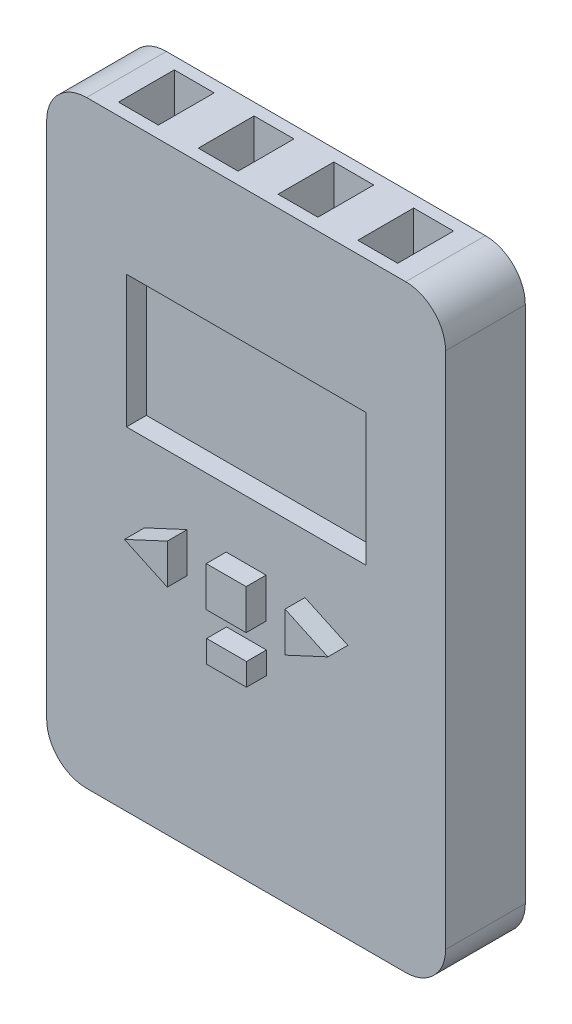
from build123d import *

# Parameters (mm, degrees)
BOSS_EXTRUDE1_DEPTH   = 2
SKETCH3_W             = 1
SKETCH3_H             = 1.4
CUT_EXTRUDE2_DEPTH    = 1
SKETCH2_W             = 1
SKETCH2_H             = 1.4
CUT_EXTRUDE3_DEPTH    = 1
SKETCH4_W             = 6
SKETCH4_H             = 3.316332314
SKETCH4_W_2           = 1
SKETCH4_H_2           = 1
SKETCH4_H_3           = 0.559018778
CUT_EXTRUDE4_DEPTH    = 0.5
BOSS_EXTRUDE2_DEPTH   = 0.5
SKETCH5_W             = 1
SKETCH5_H             = 1
BOSS_EXTRUDE2_2_DEPTH = 0.5
SKETCH5_H_2           = 0.559018778
BOSS_EXTRUDE2_3_DEPTH = 0.5
BOSS_EXTRUDE2_4_DEPTH = 0.5


with BuildPart() as part:
    # Sketch1 → Boss-Extrude1 (new body)
    with BuildSketch(Plane.XY):
        with BuildLine():
            Line((-4, 7.5), (4, 7.5))
            ThreePointArc((4, 7.5), (4.707106781, 7.207106781), (5, 6.5))
            Line((5, 6.5), (5, -6.5))
            ThreePointArc((5, -6.5), (4.707106781, -7.207106781), (4, -7.5))
            Line((4, -7.5), (-4, -7.5))
            ThreePointArc((-4, -7.5), (-4.707106781, -7.207106781), (-5, -6.5))
            Line((-5, -6.5), (-5, 6.5))
            ThreePointArc((-5, 6.5), (-4.707106781, 7.207106781), (-4, 7.5))
        make_face()
    extrude(amount=BOSS_EXTRUDE1_DEPTH)

    # Sketch3 → Cut-Extrude2 (cut)
    with BuildSketch(Plane(origin=(0, -7.5, 0), x_dir=(-1, 0, 0), z_dir=(0, -1, 0))):
        with Locations((-3, -1)):
            Rectangle(SKETCH3_W, SKETCH3_H)
        with Locations((-1, -1)):
            Rectangle(SKETCH3_W, SKETCH3_H)
        with Locations((1, -1)):
            Rectangle(SKETCH3_W, SKETCH3_H)
        with Locations((3, -1)):
            Rectangle(SKETCH3_W, SKETCH3_H)
    extrude(amount=-CUT_EXTRUDE2_DEPTH, mode=Mode.SUBTRACT)

    # Sketch2 → Cut-Extrude3 (cut)
    with BuildSketch(Plane(origin=(0, 7.5, 0), x_dir=(1, 0, 0), z_dir=(0, 1, 0))):
        with Locations((-1, -1)):
            Rectangle(SKETCH2_W, SKETCH2_H)
        with Locations((1, -1)):
            Rectangle(SKETCH2_W, SKETCH2_H)
        with Locations((3, -1)):
            Rectangle(SKETCH2_W, SKETCH2_H)
        with Locations((-3, -1)):
            Rectangle(SKETCH2_W, SKETCH2_H)
    extrude(amount=-CUT_EXTRUDE3_DEPTH, mode=Mode.SUBTRACT)

    # Sketch4 → Cut-Extrude4 (cut)
    with BuildSketch(Plane.XY.offset(2)):
        with Locations((0, 2.505950357)):
            Rectangle(SKETCH4_W, SKETCH4_H)
        Polygon((1.475933968, -0.619829312), (1.475933968, -1.619829312), (2.550668767, -1.119829312), align=None)
        with Locations((0, -1.119829312)):
            Rectangle(SKETCH4_W_2, SKETCH4_H_2)
        with Locations((0.009064429, -2.520688379)):
            Rectangle(SKETCH4_W_2, SKETCH4_H_3)
        Polygon((-1.475933968, -0.619829312), (-1.475933968, -1.619829312), (-2.550668767, -1.119829312), align=None)
    extrude(amount=-CUT_EXTRUDE4_DEPTH, mode=Mode.SUBTRACT)


with BuildPart() as body_2:
    # Sketch5 → Boss-Extrude2 (new body)
    with BuildSketch(Plane.XY.offset(2)):
        Polygon((1.475933968, -0.619829312), (1.475933968, -1.619829312), (2.550668767, -1.119829312), align=None)
    extrude(amount=BOSS_EXTRUDE2_DEPTH)


with BuildPart() as body_3:
    # Sketch5 → Boss-Extrude2 2 (new body)
    with BuildSketch(Plane.XY.offset(2)):
        with Locations((0, -1.119829312)):
            Rectangle(SKETCH5_W, SKETCH5_H)
    extrude(amount=BOSS_EXTRUDE2_2_DEPTH)


with BuildPart() as body_4:
    # Sketch5 → Boss-Extrude2 3 (new body)
    with BuildSketch(Plane.XY.offset(2)):
        with Locations((0.009064429, -2.520688379)):
            Rectangle(SKETCH5_W, SKETCH5_H_2)
    extrude(amount=BOSS_EXTRUDE2_3_DEPTH)


with BuildPart() as body_5:
    # Sketch5 → Boss-Extrude2 4 (new body)
    with BuildSketch(Plane.XY.offset(2)):
        Polygon((-1.475933968, -1.619829312), (-1.475933968, -0.619829312), (-2.550668767, -1.119829312), align=None)
    extrude(amount=BOSS_EXTRUDE2_4_DEPTH)


solid = Compound([part.part, body_2.part, body_3.part, body_4.part, body_5.part])
